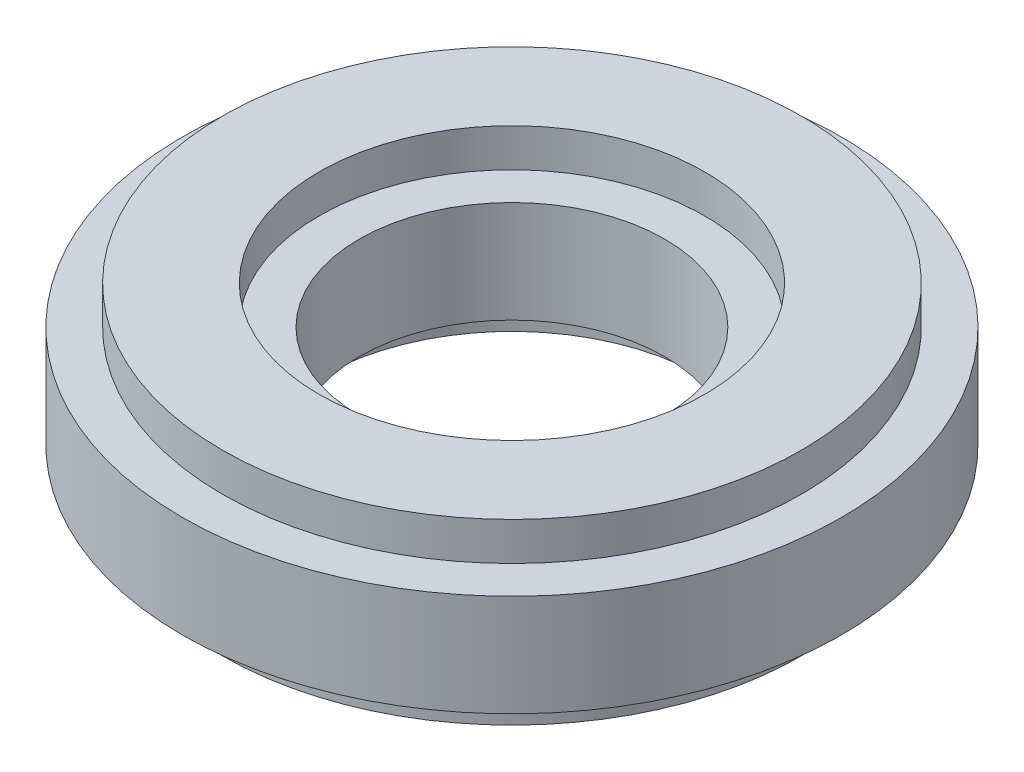
from build123d import *

# Parameters (mm, degrees)
SKETCH1_W = 13.9
SKETCH1_H = 8
SKETCH2_W = 7.595873634
SKETCH2_H = 14


with BuildPart() as part:
    # Sketch1 → Revolve1 (revolve)
    with BuildSketch(Plane.XY):
        with Locations((-18.95, 0)):
            Rectangle(SKETCH1_W, SKETCH1_H)
    revolve(axis=Axis((0, 0, 0), (0, -1, 0)))

    # Sketch2 → Revolve2 (revolve)
    with BuildSketch(Plane.XY):
        with Locations((-18.95, 0)):
            Rectangle(SKETCH2_W, SKETCH2_H)
    revolve(axis=Axis((0, 0, 0), (0, -1, 0)))


solid = part.part
